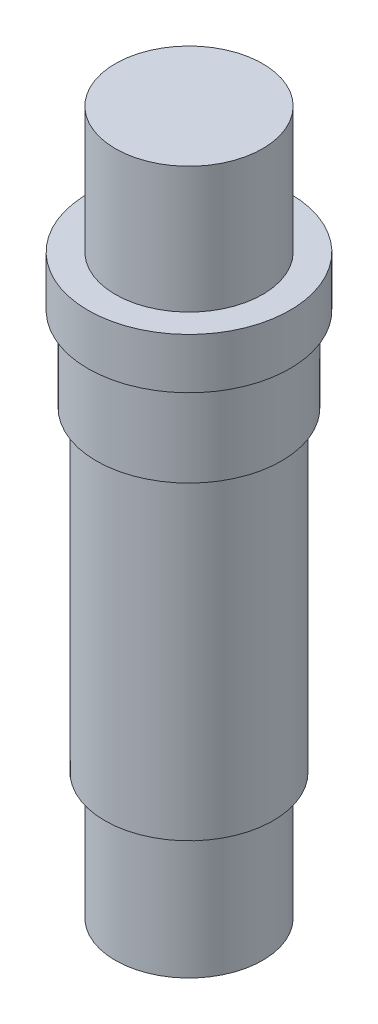
from build123d import *

# Parameters (mm, degrees)
SKETCH_1_R      = 17.5
EXTRUDE_1_DEPTH = 30
SKETCH_2_R      = 20
EXTRUDE_2_DEPTH = 75
SKETCH_3_R      = 22
EXTRUDE_3_DEPTH = 20
SKETCH_5_R      = 24
EXTRUDE_4_DEPTH = 12
SKETCH_6_R      = 17.5
EXTRUDE_5_DEPTH = 30


with BuildPart() as part:
    # 草图1 → 凸台-拉伸1 (new body)
    with BuildSketch(Plane(origin=(0, 0, 0), x_dir=(1, 0, 0), z_dir=(0, 1, 0))):
        with Locations(Location((0, 0, 0), (0, 0, 270))):
            Circle(SKETCH_1_R)
    extrude(amount=EXTRUDE_1_DEPTH)

    # 草图2 → 凸台-拉伸2 (add)
    with BuildSketch(Plane(origin=(0, 30, 0), x_dir=(1, 0, 0), z_dir=(0, 1, 0))):
        with Locations(Location((0, 0, 0), (0, 0, 270))):
            Circle(SKETCH_2_R)
    extrude(amount=EXTRUDE_2_DEPTH)

    # 草图3 → 凸台-拉伸3 (add)
    with BuildSketch(Plane(origin=(0, 105, 0), x_dir=(1, 0, 0), z_dir=(0, 1, 0))):
        with Locations(Location((0, 0, 0), (0, 0, 270))):
            Circle(SKETCH_3_R)
    extrude(amount=EXTRUDE_3_DEPTH)

    # 草图5 → 凸台-拉伸4 (add)
    with BuildSketch(Plane(origin=(0, 125, 0), x_dir=(1, 0, 0), z_dir=(0, 1, 0))):
        with Locations(Location((0, 0, 0), (0, 0, 270))):
            Circle(SKETCH_5_R)
    extrude(amount=EXTRUDE_4_DEPTH)

    # 草图6 → 凸台-拉伸5 (add)
    with BuildSketch(Plane(origin=(0, 137, 0), x_dir=(1, 0, 0), z_dir=(0, 1, 0))):
        with Locations(Location((0, 0, 0), (0, 0, 270))):
            Circle(SKETCH_6_R)
    extrude(amount=EXTRUDE_5_DEPTH)


solid = part.part
